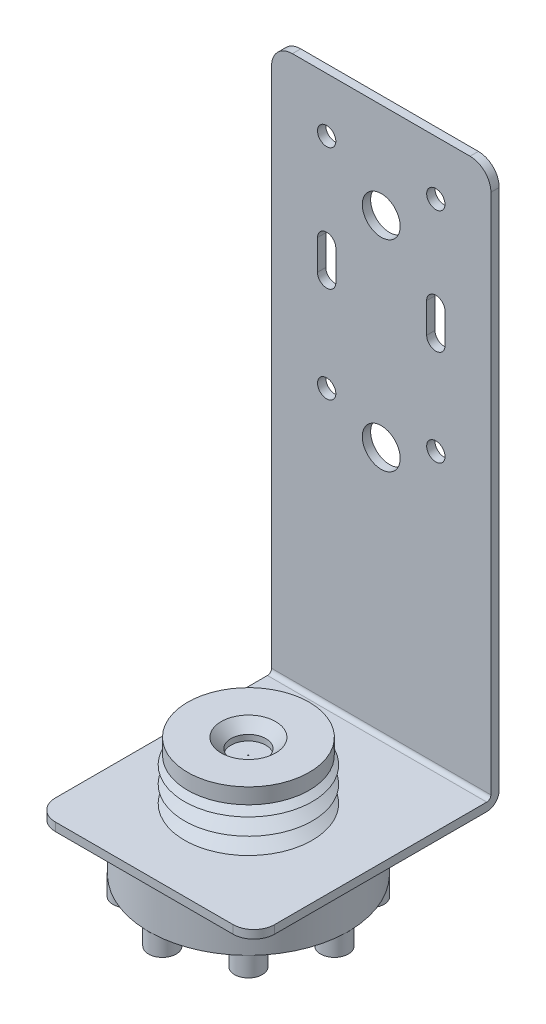
from build123d import *

# Parameters (mm, degrees)
EXTRUDE_THIN1_DEPTH = 20.066
SKETCH5_R           = 1.6764
SKETCH5_R_2         = 3.4671
EXTRUDE3_DEPTH      = 113.879851913
SKETCH6_R           = 9.144
EXTRUDE4_DEPTH      = 112.510119468
SKETCH9_R           = 2.54
EXTRUDE5_DEPTH      = 3.556
CIRPATTERN1_COUNT   = 8
FILLET1_R           = 3.81
SKETCH11_R          = 2.54
BOSS_EXTRUDE1_DEPTH = 3.556


with BuildPart() as part:
    # Sketch1 → Extrude-Thin1 (new, symmetric)
    with BuildSketch(Plane(origin=(0, 0, 0), x_dir=(0, 0, -1), z_dir=(1, 0, 0))):
        with BuildLine():
            Line((0, 101.6), (0, 2.286))
            ThreePointArc((0, 2.286), (-0.669553898, 0.669553898), (-2.286, 0))
            Line((-2.286, 0), (-44.9072, 0))
            Line((-44.9072, 0), (-44.9072, 1.524))
            Line((-44.9072, 1.524), (-2.286, 1.524))
            ThreePointArc((-2.286, 1.524), (-1.747184633, 1.747184633), (-1.524, 2.286))
            Line((-1.524, 2.286), (-1.524, 101.6))
            Line((-1.524, 101.6), (0, 101.6))
        make_face()
    extrude(amount=EXTRUDE_THIN1_DEPTH, both=True)

    # Sketch5 → Extrude3 (cut, through all)
    with BuildSketch(Plane.XY):
        with Locations((-9.98855, 91.67622)):
            Circle(SKETCH5_R)
        with Locations((-9.98855, 51.689)):
            Circle(SKETCH5_R)
        with Locations((9.98855, 51.689)):
            Circle(SKETCH5_R)
        with Locations((9.98855, 91.67622)):
            Circle(SKETCH5_R)
        with Locations((0, 84.0867)):
            Circle(SKETCH5_R_2)
        with Locations((0, 47.3075)):
            Circle(SKETCH5_R_2)
        with BuildLine():
            Line((-11.66495, 74.7522), (-11.66495, 69.2522))
            ThreePointArc((-11.66495, 69.2522), (-9.98855, 67.5758), (-8.31215, 69.2522))
            Line((-8.31215, 69.2522), (-8.31215, 74.7522))
            ThreePointArc((-8.31215, 74.7522), (-9.98855, 76.4286), (-11.66495, 74.7522))
        make_face()
        with BuildLine():
            Line((11.66495, 74.7522), (11.66495, 69.2522))
            ThreePointArc((11.66495, 69.2522), (9.98855, 67.5758), (8.31215, 69.2522))
            Line((8.31215, 69.2522), (8.31215, 74.7522))
            ThreePointArc((8.31215, 74.7522), (9.98855, 76.4286), (11.66495, 74.7522))
        make_face()
    extrude(amount=EXTRUDE3_DEPTH, mode=Mode.SUBTRACT)

    # Sketch6 → Extrude4 (cut, through all)
    with BuildSketch(Plane(origin=(0, 1.524, 0), x_dir=(1, 0, 0), z_dir=(0, 1, 0))):
        with Locations((0, -25.8318)):
            Circle(SKETCH6_R)
    extrude(amount=-EXTRUDE4_DEPTH, mode=Mode.SUBTRACT)

    # Fillet1
    fillet1_edges = [part.edges().sort_by_distance(p)[0] for p in [
        (-20.066, 101.6, 0.762),
        (20.066, 101.6, 0.762),
        (-20.066, 0.762, 44.9072),
        (20.066, 0.762, 44.9072),
    ]]
    fillet(fillet1_edges, radius=FILLET1_R)


with BuildPart() as body_2:
    # Sketch8 → Revolve1 (revolve)
    with BuildSketch(Plane(origin=(0, 0, 0), x_dir=(0, 0, -1), z_dir=(1, 0, 0))):
        Polygon((-25.9207, 10.6934), (-25.9207, -8.128), (-44.0817, -8.128), (-44.0817, 0), (-34.7218, 0), (-34.7218, 1.524), (-37.5158, 3.052233333), (-34.7218, 4.580466667), (-37.5158, 6.1087), (-34.7218, 7.636933333), (-37.5158, 9.165166667), (-34.7218, 10.6934), align=None)
    revolve(axis=Axis((0, -2.765173819, 25.8318), (0, 1, 0)))

    # Sketch9 → Extrude5 (add)
    with BuildSketch(Plane.XZ.offset(8.128)):
        with Locations((0, 41.5798)):
            Circle(SKETCH9_R)
    extrude5 = extrude(amount=EXTRUDE5_DEPTH)

    # CirPattern1: Extrude5 ×8 about axis
    cirpattern1_axis = Axis((0, 0, 25.8318), (0, 1, 0))
    for i in range(1, CIRPATTERN1_COUNT):
        add(extrude5.rotate(cirpattern1_axis, i * 360 / CIRPATTERN1_COUNT))



with BuildPart() as body_3:
    # Sketch10 → Revolve2 (revolve)
    with BuildSketch(Plane(origin=(0, 0, 0), x_dir=(0, 0, -1), z_dir=(1, 0, 0))):
        Polygon((-36.957, 13.5382), (-30.815551224, 13.5382), (-29.0195, 11.742148776), (-29.0195, -9.652), (-30.7848, -9.652), (-30.7848, 10.6934), (-36.957, 10.6934), align=None)
    revolve(axis=Axis((0, 0.950602296, 25.8318), (0, 1, 0)))


with BuildPart() as body_2_1:
    add(body_2.part)

    add(body_3.part)  # Boss-Extrude1 merges body 3
    # Sketch11 → Boss-Extrude1 (add)
    with BuildSketch(Plane.XZ.offset(8.128)):
        with Locations((-8.128, 25.8318)):
            Circle(SKETCH11_R)
        with Locations((0, 33.9598)):
            Circle(SKETCH11_R)
        with Locations((8.128, 25.8318)):
            Circle(SKETCH11_R)
        with Locations((0, 17.7038)):
            Circle(SKETCH11_R)
    extrude(amount=BOSS_EXTRUDE1_DEPTH)


solid = Compound([part.part, body_2_1.part])
